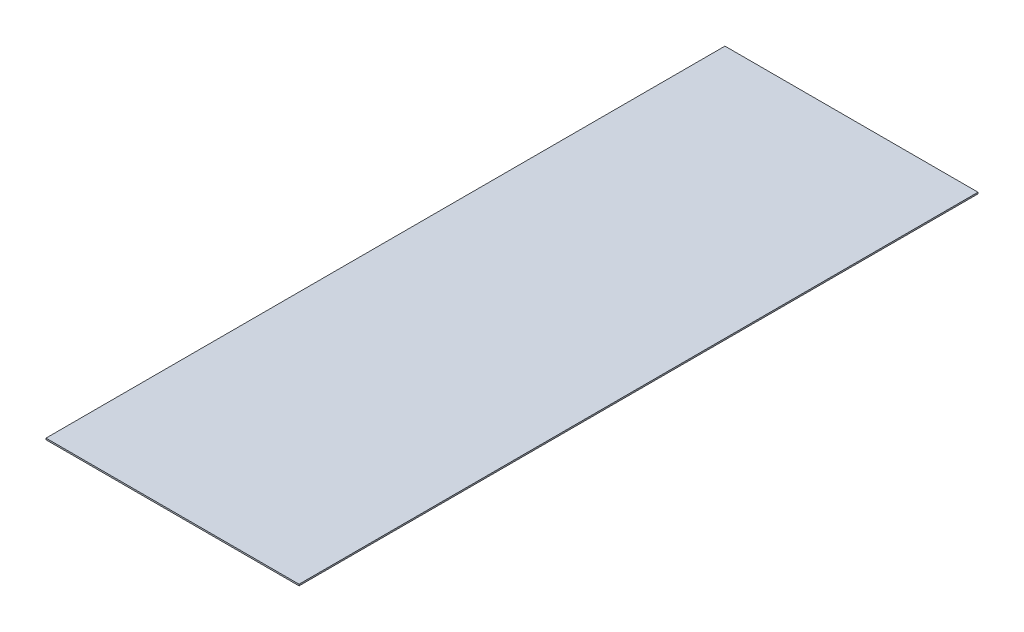
from build123d import *

# Parameters (mm, degrees)
SKETCH1_W           = 2171.7
SKETCH1_H           = 5826.76
BOSS_EXTRUDE1_DEPTH = 12.7


with BuildPart() as part:
    # Sketch1 → Boss-Extrude1 (new body)
    with BuildSketch(Plane(origin=(0, 0, 0), x_dir=(1, 0, 0), z_dir=(0, 1, 0))):
        with Locations((1085.85, 2913.38)):
            Rectangle(SKETCH1_W, SKETCH1_H)
    extrude(amount=BOSS_EXTRUDE1_DEPTH)


solid = part.part
